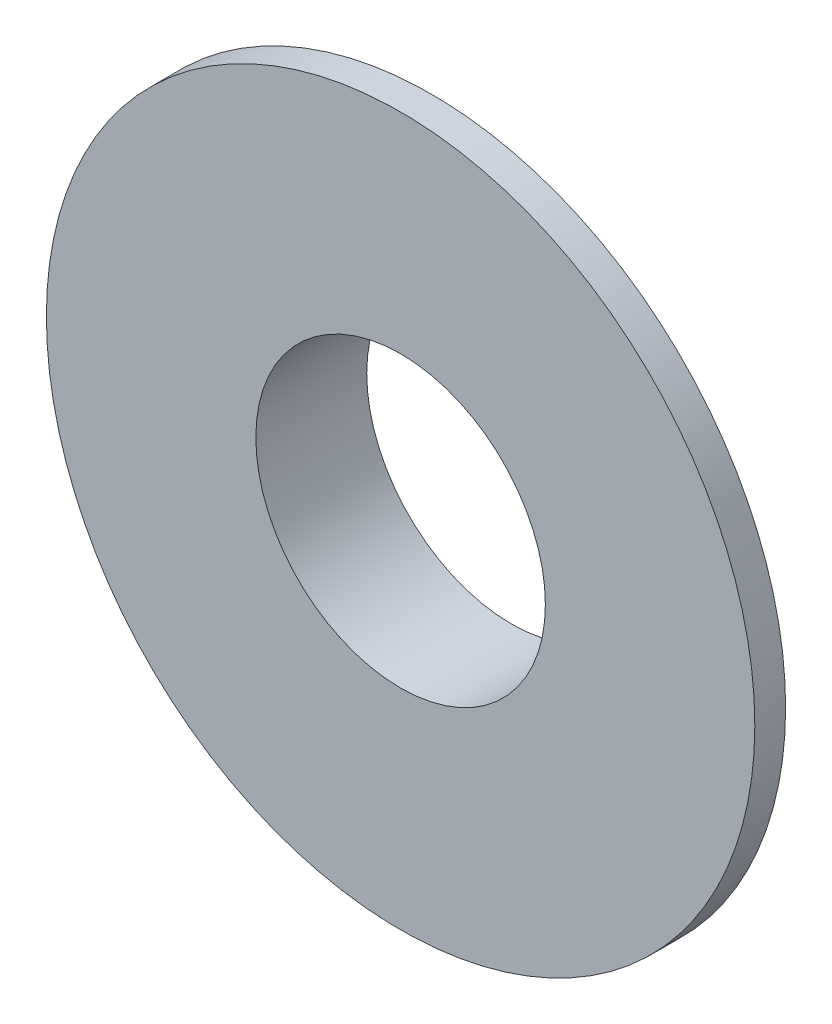
from build123d import *


with BuildPart() as part:
    # Sketch1 → Revolve1 (revolve)
    with BuildSketch(Plane(origin=(0, 0, 0), x_dir=(0, 0, -1), z_dir=(1, 0, 0)), mode=Mode.PRIVATE) as revolve1_sk:
        Polygon((-18, 57.5), (-13, 57.5), (-13, 29.25), (0, 29.25), (0, 23.5), (-18, 23.5), align=None)
    revolve(revolve1_sk.sketch.rotate(Axis((0, 0, 0), (0, 0, 1)), 90), axis=Axis((0, 0, 0), (0, 0, 1)))


solid = part.part
